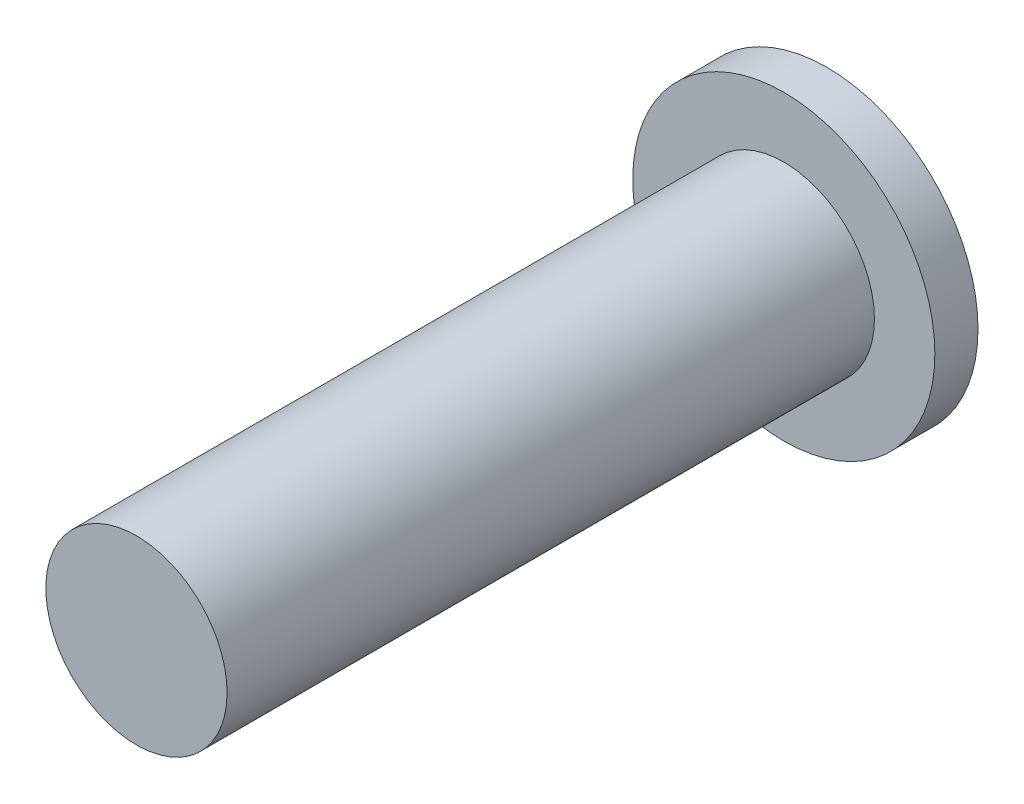
from build123d import *

# Parameters (mm, degrees)
SKETCH_1_R      = 4.2
EXTRUDE_1_DEPTH = 30
SKETCH_3_R      = 7
EXTRUDE_3_DEPTH = 2


with BuildPart() as part:
    # 草图1 → 凸台-拉伸1 (new body)
    with BuildSketch(Plane.XY):
        Circle(SKETCH_1_R)
    extrude(amount=EXTRUDE_1_DEPTH)

    # 草图3 → 凸台-拉伸3 (add)
    with BuildSketch(Plane(origin=(0, 0, 0), x_dir=(-1, 0, 0), z_dir=(0, 0, -1))):
        Circle(SKETCH_3_R)
    extrude(amount=EXTRUDE_3_DEPTH)


solid = part.part
